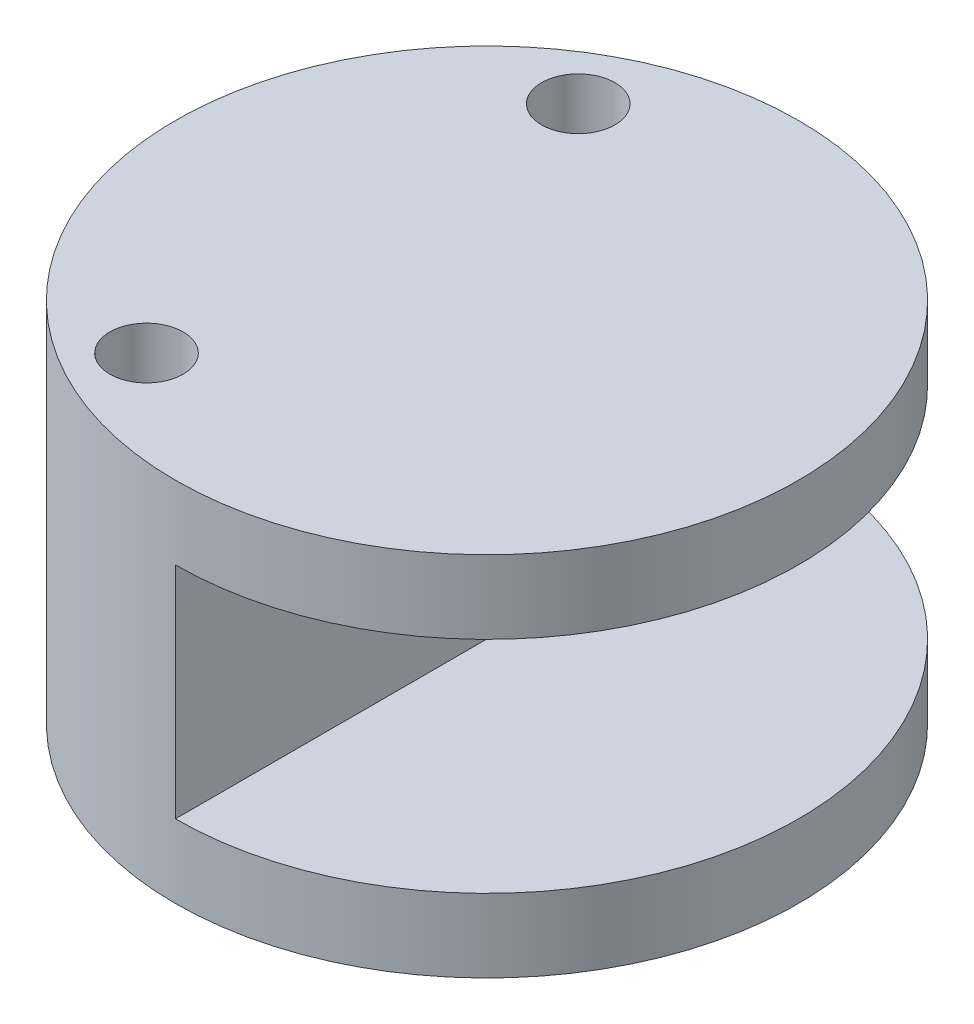
from build123d import *

# Parameters (mm, degrees)
SKETCH2_R           = 10.795
BOSS_EXTRUDE1_DEPTH = 12.7
SKETCH3_W           = 25.439299018
SKETCH3_H           = 7.62
CUT_EXTRUDE1_DEPTH  = 20.858349629
SKETCH5_R           = 1.27
CUT_EXTRUDE2_DEPTH  = 7.62


with BuildPart() as part:
    # Sketch2 → Boss-Extrude1 (new body)
    with BuildSketch(Plane(origin=(0, 0, 0), x_dir=(1, 0, 0), z_dir=(0, 1, 0))):
        with Locations(Location((0, 0, 0), (0, 0, 270))):
            Circle(SKETCH2_R)
    extrude(amount=-BOSS_EXTRUDE1_DEPTH)

    # Sketch3 → Cut-Extrude1 (cut, through all)
    with BuildSketch(Plane(origin=(0, 0, 0), x_dir=(0, 0, -1), z_dir=(1, 0, 0))):
        with Locations((-0.92844157, -6.35)):
            Rectangle(SKETCH3_W, SKETCH3_H)
    extrude(amount=CUT_EXTRUDE1_DEPTH, mode=Mode.SUBTRACT)

    # Sketch5 → Cut-Extrude2 (cut)
    with BuildSketch(Plane(origin=(0, 0, 0), x_dir=(1, 0, 0), z_dir=(0, 1, 0))):
        with Locations(Location((-4.318, -7.478995387, 0), (0, 0, 270))):
            Circle(SKETCH5_R)
        with Locations(Location((-4.318, 7.478995387, 0), (0, 0, 270))):
            Circle(SKETCH5_R)
    extrude(amount=-CUT_EXTRUDE2_DEPTH, mode=Mode.SUBTRACT)


solid = part.part
